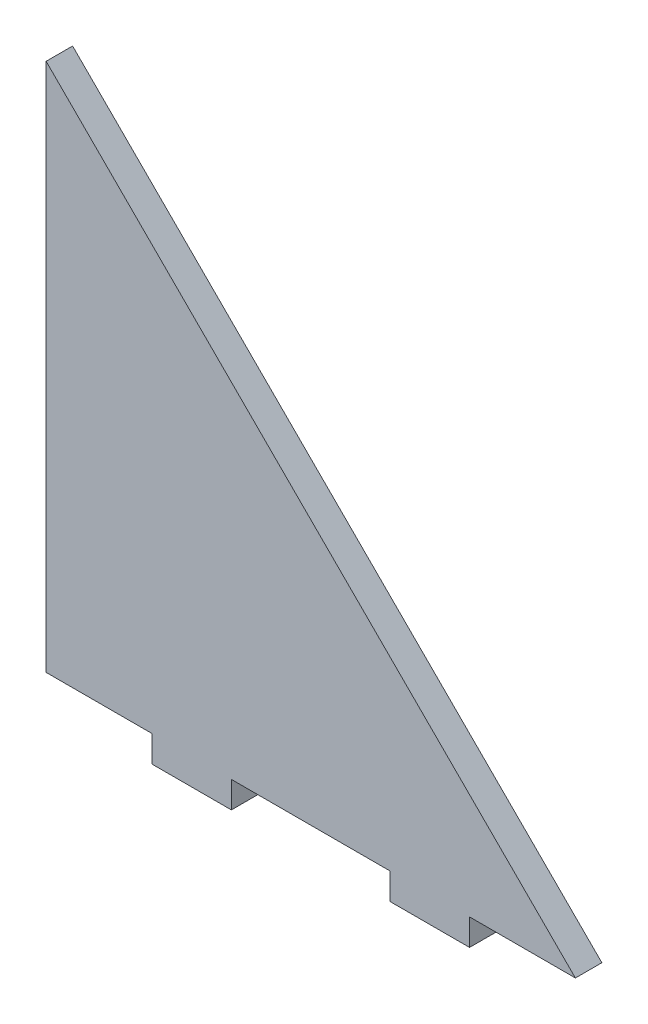
from build123d import *

# Parameters (mm, degrees)
BOSS_EXTRUDE1_DEPTH = 5


with BuildPart() as part:
    # Sketch1 → Boss-Extrude1 (new body)
    with BuildSketch(Plane.XY):
        Polygon((0, 100), (0, 0), (20, 0), (20, -5), (35, -5), (35, 0), (65, 0), (65, -5), (80, -5), (80, 0), (100, 0), align=None)
    extrude(amount=BOSS_EXTRUDE1_DEPTH)


solid = part.part
